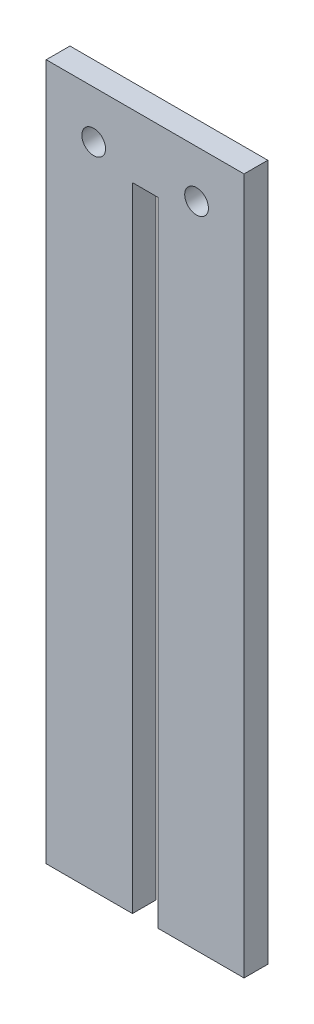
from build123d import *

# Parameters (mm, degrees)
SKETCH1_W           = 25
SKETCH1_H           = 88
BOSS_EXTRUDE1_DEPTH = 3
SKETCH2_R           = 1.5
CUT_EXTRUDE1_DEPTH  = 3
SKETCH3_W           = 3.2
SKETCH3_H           = 80
CUT_EXTRUDE2_DEPTH  = 10


with BuildPart() as part:
    # Sketch1 → Boss-Extrude1 (new body)
    with BuildSketch(Plane.XY):
        with Locations((12.5, 44)):
            Rectangle(SKETCH1_W, SKETCH1_H)
    extrude(amount=BOSS_EXTRUDE1_DEPTH)

    # Sketch2 → Cut-Extrude1 (cut)
    with BuildSketch(Plane.XY.offset(3)):
        with Locations((19, 82)):
            Circle(SKETCH2_R)
        with Locations((6, 82)):
            Circle(SKETCH2_R)
    extrude(amount=-CUT_EXTRUDE1_DEPTH, mode=Mode.SUBTRACT)

    # Sketch3 → Cut-Extrude2 (cut)
    with BuildSketch(Plane.XY.offset(3)):
        with Locations((12.5, 40)):
            Rectangle(SKETCH3_W, SKETCH3_H)
    extrude(amount=-CUT_EXTRUDE2_DEPTH, mode=Mode.SUBTRACT)


solid = part.part
